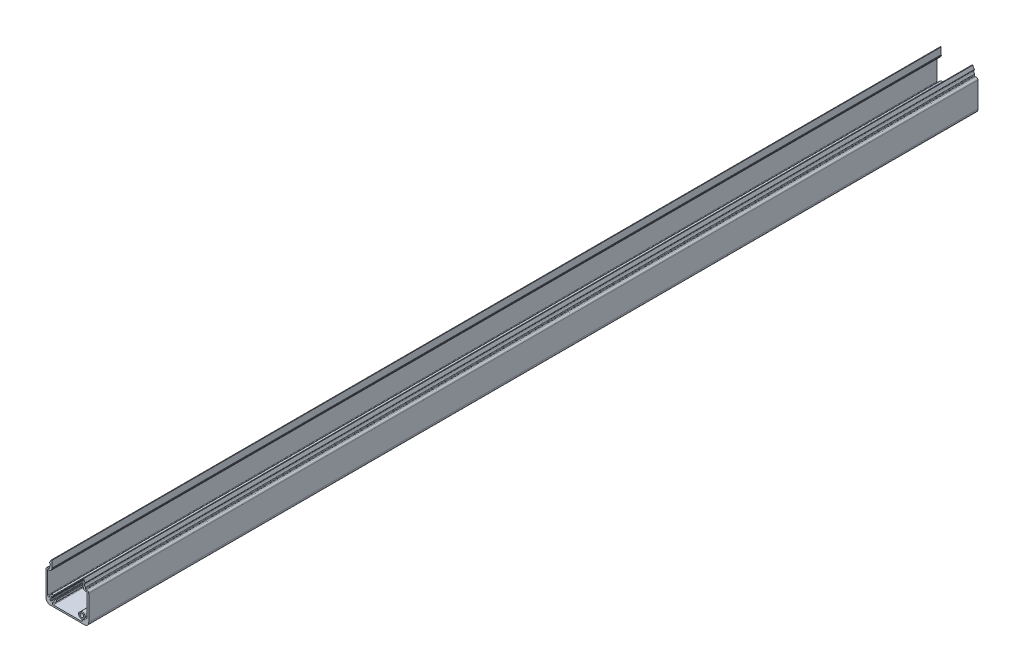
from build123d import *

# Parameters (mm, degrees)
BOSS_EXTRUDE1_DEPTH = 832


with BuildPart() as part:
    # Sketch1 → Boss-Extrude1 (new body)
    with BuildSketch(Plane.XY.offset(20)):
        with BuildLine():
            Line((4, 0), (36, 0))
            ThreePointArc((36, 0), (38.828427125, 1.171572875), (40, 4))
            Line((40, 4), (40, 27.499999994))
            ThreePointArc((40, 27.499999994), (39.56066017, 28.56066017), (38.499999994, 29))
            Line((38.499999994, 29), (37.408493132, 29))
            ThreePointArc((37.408493132, 29), (37.05493974, 29.14644661), (36.90849313, 29.500000002))
            Line((36.90849313, 29.500000002), (36.90849313, 30.572020267))
            ThreePointArc((36.90849313, 30.572020267), (36.86079319, 30.785150869), (36.726794508, 30.957616203))
            ThreePointArc((36.726794508, 30.957616203), (36.005111578, 32.357100716), (36.519951827, 33.845160752))
            ThreePointArc((36.519951827, 33.845160752), (36.647077826, 34.128030253), (36.582952488, 34.431450944))
            Line((36.582952488, 34.431450944), (35.099999998, 37.000000001))
            Line((35.099999998, 37.000000001), (34.500000002, 37.000000001))
            Line((34.500000002, 37.000000001), (34.500000002, 30.672689193))
            Line((34.500000002, 30.672689193), (34.158493132, 30.561067543))
            Line((34.158493132, 30.561067543), (34.158493132, 29.989862813))
            Line((34.158493132, 29.989862813), (34.908493132, 29.989862813))
            Line((34.908493132, 29.989862813), (34.908493132, 29.700000011))
            ThreePointArc((34.908493132, 29.700000011), (35.494279572, 28.285786443), (36.908493141, 27.700000003))
            Line((36.908493141, 27.700000003), (38.000000017, 27.700000003))
            ThreePointArc((38.000000017, 27.700000003), (38.353553409, 27.553553393), (38.500000019, 27.200000001))
            Line((38.500000019, 27.200000001), (38.500000019, 6.9547727))
            ThreePointArc((38.500000019, 6.9547727), (37.882683451, 6.030893167), (36.792893237, 6.247665919))
            Line((36.792893237, 6.247665919), (36.648161659, 6.392397496))
            ThreePointArc((36.648161659, 6.392397496), (35.587251229, 8.859212237), (33.009530056, 9.611581471))
            ThreePointArc((33.009530056, 9.611581471), (32.804700675, 9.478725012), (32.766463725, 9.237594653))
            Line((32.766463725, 9.237594653), (33.047066675, 8.190370192))
            ThreePointArc((33.047066675, 8.190370192), (34.786339421, 7.686520507), (35.148364083, 5.912296075))
            Line((35.148364083, 5.912296075), (36.146446608, 4.91421355))
            ThreePointArc((36.146446608, 4.91421355), (36.292893217, 4.560660161), (36.146446608, 4.207106773))
            Line((36.146446608, 4.207106773), (35.792893214, 3.853553379))
            ThreePointArc((35.792893214, 3.853553379), (35.439339826, 3.70710677), (35.085786437, 3.853553379))
            Line((35.085786437, 3.853553379), (34.087703906, 4.85163591))
            ThreePointArc((34.087703906, 4.85163591), (32.313479487, 5.213660585), (31.809629807, 6.952933321))
            Line((31.809629807, 6.952933321), (30.762405333, 7.233536272))
            ThreePointArc((30.762405333, 7.233536272), (30.521274984, 7.195299323), (30.38841853, 6.990469949))
            ThreePointArc((30.38841853, 6.990469949), (31.140787752, 4.412748784), (33.607602477, 3.351838341))
            Line((33.607602477, 3.351838341), (33.752334032, 3.207106785))
            ThreePointArc((33.752334032, 3.207106785), (33.969106782, 2.117316579), (33.045227255, 1.500000015))
            Line((33.045227255, 1.500000015), (6.954772716, 1.500000015))
            ThreePointArc((6.954772716, 1.500000015), (6.030893183, 2.117316583), (6.247665934, 3.207106797))
            Line((6.247665934, 3.207106797), (6.392397512, 3.351838375))
            ThreePointArc((6.392397512, 3.351838375), (8.859212224, 4.412748803), (9.611581449, 6.990469949))
            ThreePointArc((9.611581449, 6.990469949), (9.478724996, 7.195299323), (9.237594646, 7.233536272))
            Line((9.237594646, 7.233536272), (8.190370187, 6.952933328))
            ThreePointArc((8.190370187, 6.952933328), (7.686520502, 5.213660596), (5.912296085, 4.851635932))
            Line((5.912296085, 4.851635932), (4.914213553, 3.8535534))
            ThreePointArc((4.914213553, 3.8535534), (4.560660164, 3.707106791), (4.207106776, 3.8535534))
            Line((4.207106776, 3.8535534), (3.853553388, 4.207106787))
            ThreePointArc((3.853553388, 4.207106787), (3.70710678, 4.560660175), (3.853553388, 4.914213564))
            Line((3.853553388, 4.914213564), (4.85163592, 5.912296095))
            ThreePointArc((4.85163592, 5.912296095), (5.213660585, 7.686520517), (6.952933322, 8.190370198))
            Line((6.952933322, 8.190370198), (7.233536268, 9.237594644))
            ThreePointArc((7.233536268, 9.237594644), (7.195299318, 9.478725003), (6.990469936, 9.611581462))
            ThreePointArc((6.990469936, 9.611581462), (4.412748785, 8.859212233), (3.351838362, 6.392397513))
            Line((3.351838362, 6.392397513), (3.207106785, 6.247665935))
            ThreePointArc((3.207106785, 6.247665935), (2.11731657, 6.030893183), (1.500000002, 6.954772717))
            Line((1.500000002, 6.954772717), (1.500000002, 27.200000001))
            ThreePointArc((1.500000002, 27.200000001), (1.646446612, 27.553553393), (2.000000004, 27.700000003))
            Line((2.000000004, 27.700000003), (3.091506864, 27.700000003))
            ThreePointArc((3.091506864, 27.700000003), (4.505720432, 28.285786443), (5.091506872, 29.700000011))
            Line((5.091506872, 29.700000011), (5.091506872, 29.989862813))
            Line((5.091506872, 29.989862813), (5.841506868, 29.989862813))
            Line((5.841506868, 29.989862813), (5.841506868, 30.561067541))
            Line((5.841506868, 30.561067541), (5.499999998, 30.672689191))
            Line((5.499999998, 30.672689191), (5.499999998, 37.000000001))
            Line((5.499999998, 37.000000001), (4.899999998, 37.000000001))
            Line((4.899999998, 37.000000001), (3.417047508, 34.431450944))
            ThreePointArc((3.417047508, 34.431450944), (3.35292217, 34.128030253), (3.480048169, 33.845160751))
            ThreePointArc((3.480048169, 33.845160751), (3.99488842, 32.357100716), (3.273205491, 30.957616203))
            ThreePointArc((3.273205491, 30.957616203), (3.13920681, 30.785150869), (3.09150687, 30.572020267))
            Line((3.09150687, 30.572020267), (3.09150687, 29.500000002))
            ThreePointArc((3.09150687, 29.500000002), (2.94506026, 29.14644661), (2.591506868, 29))
            Line((2.591506868, 29), (1.500000006, 29))
            ThreePointArc((1.500000006, 29), (0.43933983, 28.56066017), (0, 27.499999994))
            Line((0, 27.499999994), (0, 4))
            ThreePointArc((0, 4), (1.171572875, 1.171572875), (4, 0))
        make_face()
    extrude(amount=-BOSS_EXTRUDE1_DEPTH)


solid = part.part
